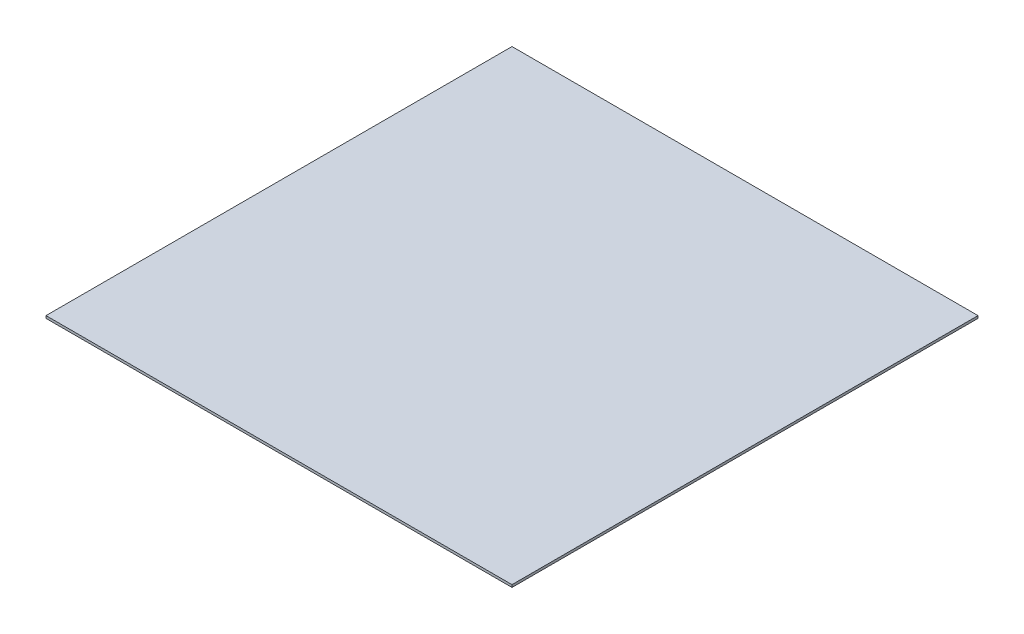
from build123d import *

# Parameters (mm, degrees)
SKETCH1_W           = 76.2
SKETCH1_H           = 76.2
BOSS_EXTRUDE1_DEPTH = 0.4


with BuildPart() as part:
    # Sketch1 → Boss-Extrude1 (new body)
    with BuildSketch(Plane(origin=(0, 0, 0), x_dir=(1, 0, 0), z_dir=(0, 1, 0))):
        Rectangle(SKETCH1_W, SKETCH1_H)
    extrude(amount=BOSS_EXTRUDE1_DEPTH)


solid = part.part
